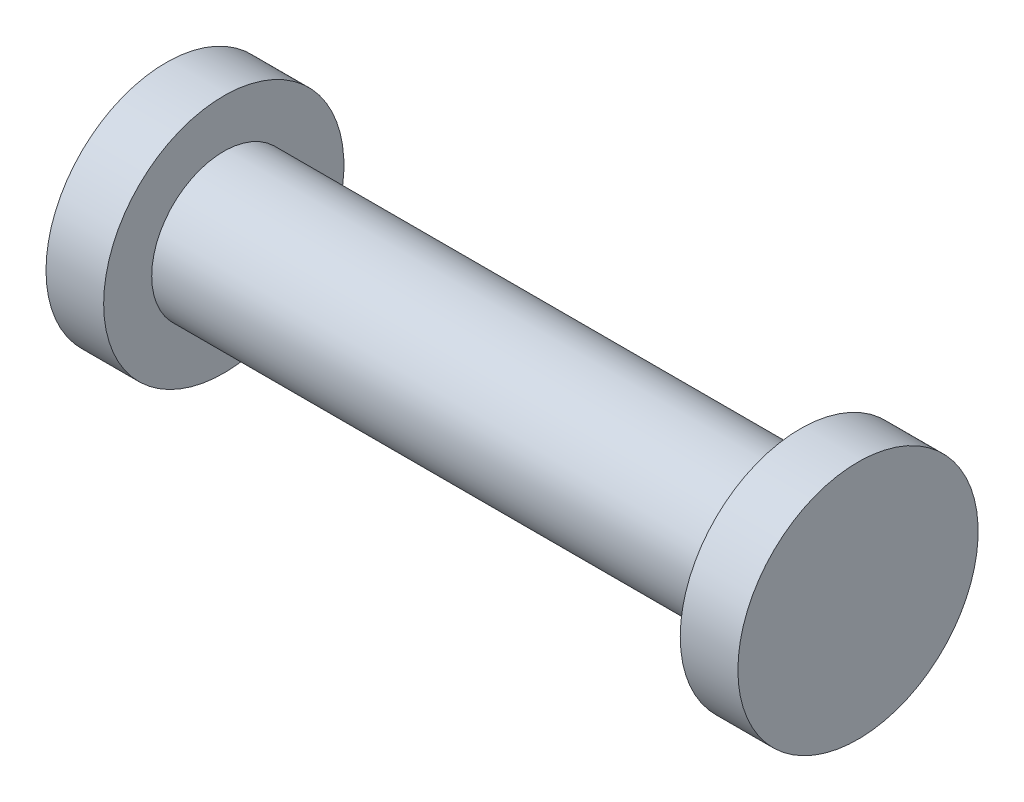
from build123d import *


with BuildPart() as part:
    # Sketch1 → Revolve1 (revolve)
    with BuildSketch(Plane(origin=(0, 0, 0), x_dir=(1, 0, 0), z_dir=(0, 1, 0)), mode=Mode.PRIVATE) as revolve1_sk:
        Polygon((0, 0), (-36, 0), (-36, 12.5), (-30, 12.5), (-30, 7.5), (30, 7.5), (30, 12.5), (36, 12.5), (36, 0), align=None)
    revolve(revolve1_sk.sketch.rotate(Axis((-414.016836438, 0, 0), (1, 0, 0)), 180), axis=Axis((-414.016836438, 0, 0), (1, 0, 0)))


solid = part.part
